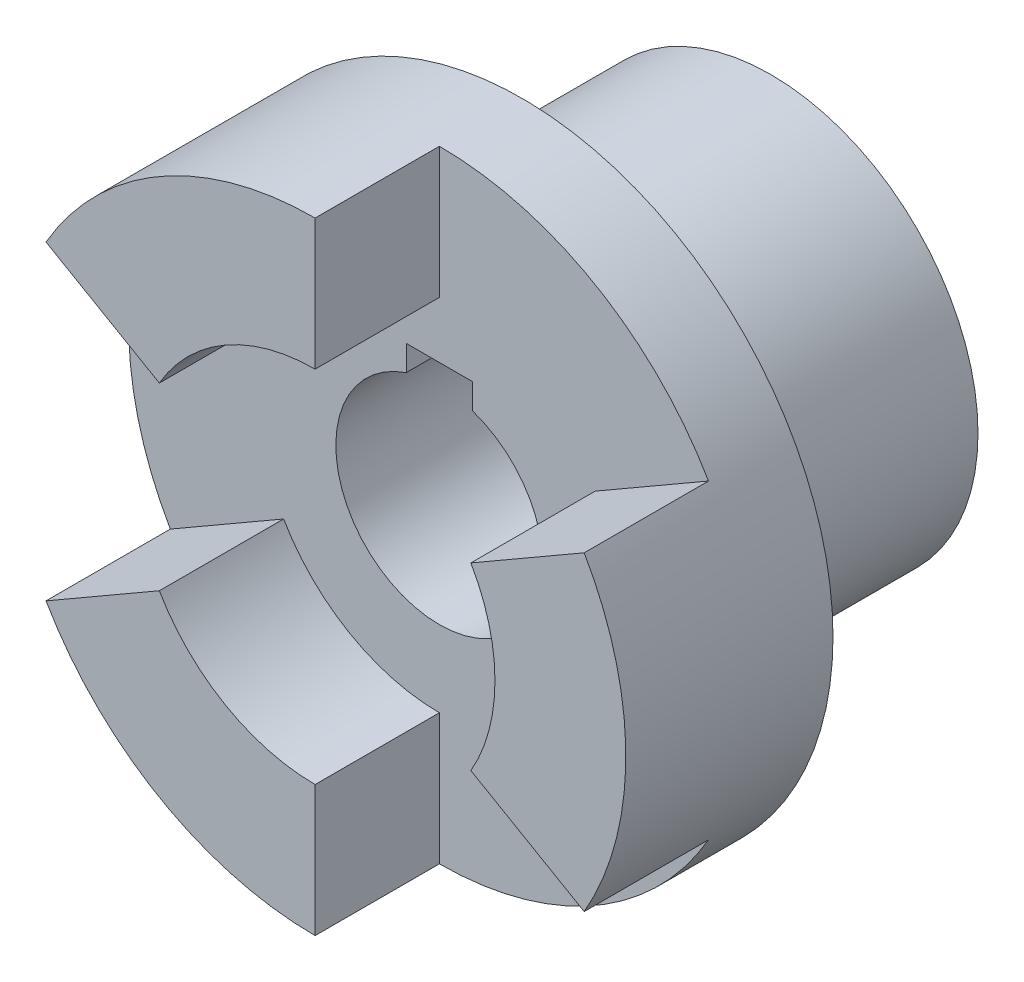
from build123d import *
from build123d.topology import SkipClean

# Parameters (mm, degrees)
SKETCH1_R           = 37.5
BOSS_EXTRUDE1_DEPTH = 10
BOSS_EXTRUDE2_DEPTH = 15
BOSS_EXTRUDE3_START = 30
SKETCH5_R           = 25
SKETCH5_R_2         = 12.5
BOSS_EXTRUDE3_DEPTH = 30
CUT_EXTRUDE1_DEPTH  = 4


with BuildPart() as part:
    # Sketch1 → Boss-Extrude1 (new body)
    with BuildSketch(Plane.XY):
        Circle(SKETCH1_R)
        with BuildLine():
            ThreePointArc((-4, 11.842719282), (0, -12.5), (4, 11.842719282))
            ThreePointArc((4, 11.842719282), (0, 12.5), (-4, 11.842719282))
        make_face(mode=Mode.SUBTRACT)
    extrude(amount=BOSS_EXTRUDE1_DEPTH)

    # Sketch3 → Boss-Extrude2 (add)
    with SkipClean():  # the faces are left unmerged after this step: merging them gives an invalid solid
        with BuildSketch(Plane.XY.offset(10)):
            with BuildLine():
                Line((-32.475952642, -18.75), (-18.798362826, -10.853239838))
                ThreePointArc((-18.798362826, -10.853239838), (-10.853239838, -18.798362826), (0, -21.706479676))
                Line((0, -21.706479676), (0, -37.5))
                ThreePointArc((0, -37.5), (-18.75, -32.475952642), (-32.475952642, -18.75))
            make_face()
            with BuildLine():
                Line((0, 37.5), (0, 21.706479676))
                ThreePointArc((0, 21.706479676), (-10.853239838, 18.798362826), (-18.798362826, 10.853239838))
                Line((-18.798362826, 10.853239838), (-32.475952642, 18.75))
                ThreePointArc((-32.475952642, 18.75), (-18.75, 32.475952642), (0, 37.5))
            make_face()
            with BuildLine():
                Line((32.475952642, -18.75), (18.798362826, -10.853239838))
                ThreePointArc((18.798362826, -10.853239838), (21.706479676, 0), (18.798362826, 10.853239838))
                Line((18.798362826, 10.853239838), (32.475952642, 18.75))
                ThreePointArc((32.475952642, 18.75), (37.5, 0), (32.475952642, -18.75))
            make_face()
        extrude(amount=BOSS_EXTRUDE2_DEPTH)

    # Sketch5 → Boss-Extrude3 (add)
    with SkipClean():  # the faces are left unmerged after this step: merging them gives an invalid solid
        with BuildSketch(Plane(origin=(0, 0, 0), x_dir=(-1, 0, 0), z_dir=(0, 0, -1)).offset(BOSS_EXTRUDE3_START)):
            with Locations(Location((0, 0, 0), (0, 0, 180))):
                Circle(SKETCH5_R)
            Circle(SKETCH5_R_2, mode=Mode.SUBTRACT)
        extrude(amount=-BOSS_EXTRUDE3_DEPTH)

    # Sketch7 → Cut-Extrude1 (cut, symmetric)
    with SkipClean():  # the faces are left unmerged after this step: merging them gives an invalid solid
        with BuildSketch(Plane(origin=(0, 0, 0), x_dir=(0, 0, -1), z_dir=(1, 0, 0))):
            Polygon((30, 0), (-10, 0), (-10, 14.9), (30, 14.5), align=None)
        extrude(amount=CUT_EXTRUDE1_DEPTH, both=True, mode=Mode.SUBTRACT)


solid = part.part
